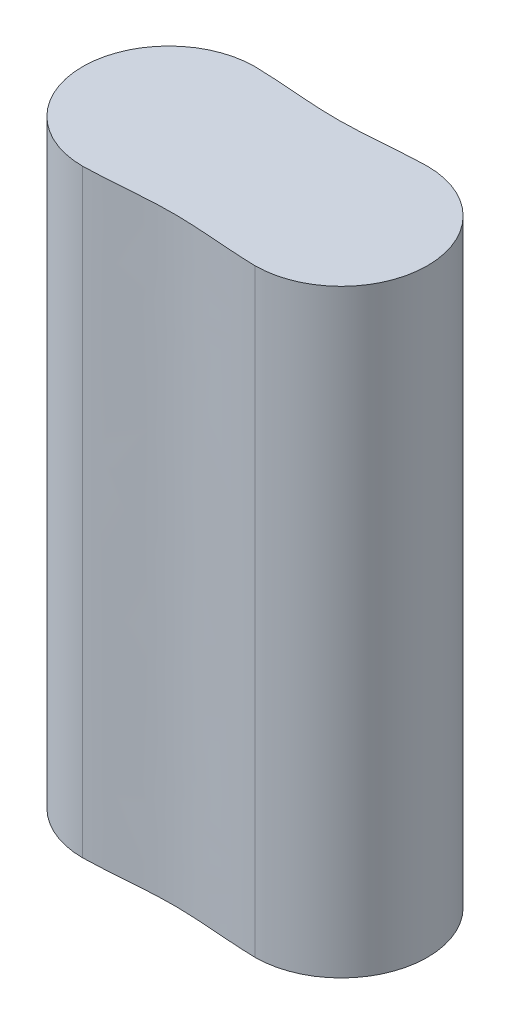
from build123d import *

# Parameters (mm, degrees)
BOSS_EXTRUDE1_DEPTH = 66


with BuildPart() as part:
    # Sketch1 → Boss-Extrude1 (new body)
    with BuildSketch(Plane(origin=(0, 0, 0), x_dir=(1, 0, 0), z_dir=(0, 1, 0))):
        with BuildLine():
            ThreePointArc((0.496605757, 9.487011264), (6.890854617, 6.539581229), (9.5, 0))
            Line((9.5, 0), (9.5, 9))
            add(Edge.make_bspline(
                [(0.496605757, 9.487011264), (3.439590397, 9.392632679), (6.469795198, 9), (9.5, 9)],
                knots=[0.303368247, 0.303368247, 0.303368247, 0.303368247, 0.5, 0.5, 0.5, 0.5], degree=3))
        make_face()
        with BuildLine():
            ThreePointArc((0.496605757, -9.487011264), (6.890854617, -6.539581229), (9.5, 0))
            ThreePointArc((9.5, 0), (6.890854617, 6.539581229), (0.496605757, 9.487011264))
            add(Edge.make_bspline(
                [(0, 9.5), (0.165247966, 9.496699631), (0.330788419, 9.492328861), (0.496605757, 9.487011264)],
                knots=[0.292289374, 0.292289374, 0.292289374, 0.292289374, 0.303368247, 0.303368247, 0.303368247, 0.303368247], degree=3))
            ThreePointArc((0, 9.5), (-9.5, 0), (0, -9.5))
            add(Edge.make_bspline(
                [(0, -9.5), (0.165247966, -9.496699631), (0.330788419, -9.492328861), (0.496605757, -9.487011264)],
                knots=[0.292289374, 0.292289374, 0.292289374, 0.292289374, 0.303368247, 0.303368247, 0.303368247, 0.303368247], degree=3))
        make_face()
        with BuildLine():
            ThreePointArc((18.503394243, -9.487011264), (12.109145383, -6.539581229), (9.5, 0))
            ThreePointArc((9.5, 0), (6.890854617, -6.539581229), (0.496605757, -9.487011264))
            add(Edge.make_bspline(
                [(0.496605757, -9.487011264), (3.439590397, -9.392632679), (9.5, -8.607367321), (15.560409603, -9.392632679), (18.503394243, -9.487011264)],
                knots=[0.303368247, 0.303368247, 0.303368247, 0.303368247, 0.5, 0.696631753, 0.696631753, 0.696631753, 0.696631753], degree=3))
        make_face()
        with BuildLine():
            Line((9.5, 9), (9.5, 0))
            ThreePointArc((9.5, 0), (12.109145383, 6.539581229), (18.503394243, 9.487011264))
            add(Edge.make_bspline(
                [(9.5, 9), (12.530204802, 9), (15.560409603, 9.392632679), (18.503394243, 9.487011264)],
                knots=[0.5, 0.5, 0.5, 0.5, 0.696631753, 0.696631753, 0.696631753, 0.696631753], degree=3))
        make_face()
        with BuildLine():
            ThreePointArc((18.503394243, 9.487011264), (12.109145383, 6.539581229), (9.5, 0))
            ThreePointArc((9.5, 0), (12.109145383, -6.539581229), (18.503394243, -9.487011264))
            add(Edge.make_bspline(
                [(18.503394243, -9.487011264), (18.669211581, -9.492328861), (18.834752034, -9.496699631), (19, -9.5)],
                knots=[0.696631753, 0.696631753, 0.696631753, 0.696631753, 0.707710626, 0.707710626, 0.707710626, 0.707710626], degree=3))
            ThreePointArc((19, -9.5), (25.717514421, -6.717514421), (28.5, 0))
            ThreePointArc((28.5, 0), (25.717514421, 6.717514421), (19, 9.5))
            add(Edge.make_bspline(
                [(18.503394243, 9.487011264), (18.669211581, 9.492328861), (18.834752034, 9.496699631), (19, 9.5)],
                knots=[0.696631753, 0.696631753, 0.696631753, 0.696631753, 0.707710626, 0.707710626, 0.707710626, 0.707710626], degree=3))
        make_face()
    extrude(amount=BOSS_EXTRUDE1_DEPTH)


solid = part.part
